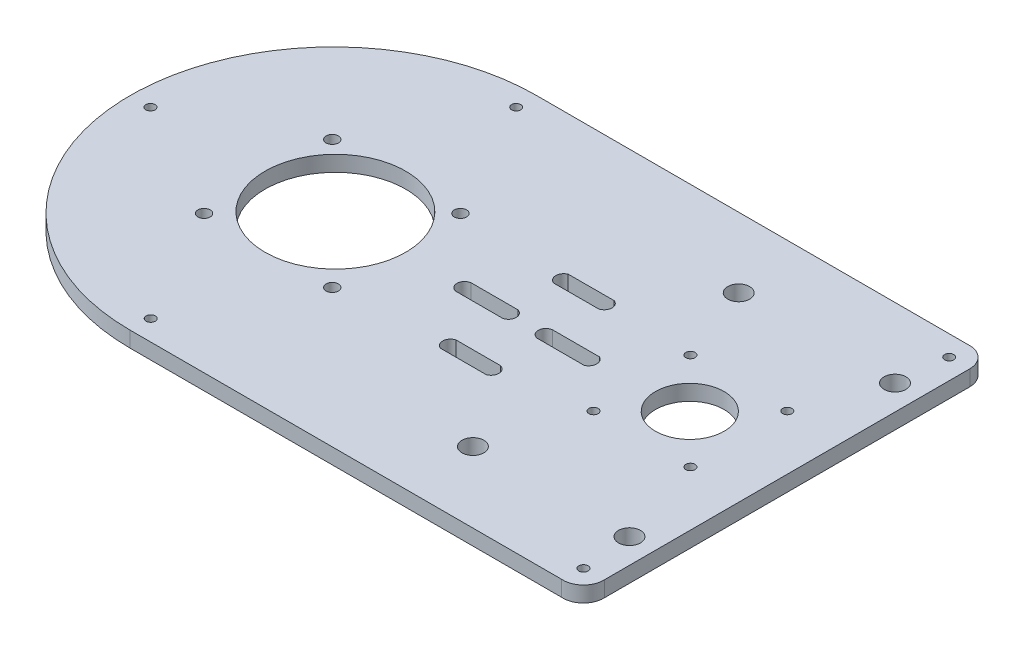
from build123d import *

# Parameters (mm, degrees)
BOSS_EXTRUDE1_DEPTH = 5
SKETCH3_R           = 1.475
CUT_EXTRUDE1_DEPTH  = 137.064643721
SKETCH4_R           = 22.5
SKETCH4_R_2         = 11
SKETCH4_R_3         = 1.975
SKETCH4_R_4         = 1.475
SKETCH4_R_5         = 3.5
CUT_EXTRUDE2_DEPTH  = 137.064643721


with BuildPart() as part:
    # Sketch2 → Boss-Extrude1 (new body)
    with BuildSketch(Plane(origin=(0, 0, 0), x_dir=(1, 0, 0), z_dir=(0, 1, 0))):
        with BuildLine():
            Line((-52.202038886, 61.082677165), (85.797961114, 61.082677165))
            ThreePointArc((85.797961114, 61.082677165), (90.6611457, 59.421487905), (92.797961114, 54.747717054))
            Line((92.797961114, 54.747717054), (92.797961114, -62.252282946))
            ThreePointArc((92.797961114, -62.252282946), (90.782438223, -67.143884297), (85.797961114, -68.917322835))
            Line((85.797961114, -68.917322835), (-52.202038886, -68.917322835))
            ThreePointArc((-52.202038886, -68.917322835), (-117.202038886, -3.917322835), (-52.202038886, 61.082677165))
        make_face()
    extrude(amount=BOSS_EXTRUDE1_DEPTH)

    # Sketch3 → Cut-Extrude1 (cut, through all)
    with BuildSketch(Plane(origin=(0, 5, 0), x_dir=(1, 0, 0), z_dir=(0, 1, 0))):
        with Locations(Location((86.297961114, 54.582677165, 0), (0, 0, 270))):
            Circle(SKETCH3_R)
        with Locations(Location((-52.202038886, 54.582677165, 0), (0, 0, 270))):
            Circle(SKETCH3_R)
        with Locations(Location((-110.702038886, -3.912214457, 0), (0, 0, 270))):
            Circle(SKETCH3_R)
        with Locations(Location((86.297961114, -62.417322835, 0), (0, 0, 90))):
            Circle(SKETCH3_R)
        with Locations(Location((-52.11000774, -62.417322835, 0), (0, 0, 90))):
            Circle(SKETCH3_R)
    extrude(amount=-CUT_EXTRUDE1_DEPTH, mode=Mode.SUBTRACT)

    # Sketch4 → Cut-Extrude2 (cut, through all)
    with BuildSketch(Plane(origin=(0, 5, 0), x_dir=(1, 0, 0), z_dir=(0, 1, 0))):
        with BuildLine():
            Line((17.035736777, 16.673447137), (2.353343762, 16.650369213))
            ThreePointArc((2.353343762, 16.650369213), (0.763165117, 14.196667771), (2.526429623, 11.864240457))
            Line((2.526429623, 11.864240457), (16.842011582, 11.886741824))
            ThreePointArc((16.842011582, 11.886741824), (18.721537255, 14.207947413), (17.035736777, 16.673447137))
        make_face()
        with BuildLine():
            Line((4.221952, -1.260399725), (-10.778048, -1.260399725))
            ThreePointArc((-10.778048, -1.260399725), (-12.893391284, -3.603735064), (-10.910792873, -6.060399725))
            Line((-10.910792873, -6.060399725), (4.221952, -6.060399725))
            ThreePointArc((4.221952, -6.060399725), (6.021952, -3.660399725), (4.221952, -1.260399725))
        make_face()
        with BuildLine():
            Line((30.221952, -1.260399725), (15.221952, -1.260399725))
            ThreePointArc((15.221952, -1.260399725), (13.106608716, -3.603735064), (15.089207127, -6.060399725))
            Line((15.089207127, -6.060399725), (30.147453765, -6.060399725))
            ThreePointArc((30.147453765, -6.060399725), (31.77239266, -3.68504141), (30.221952, -1.260399725))
        make_face()
        with BuildLine():
            Line((16.866686946, -19.510676527), (2.551087303, -19.510676527))
            ThreePointArc((2.551087303, -19.510676527), (0.791491102, -21.845872472), (2.385524529, -24.297071429))
            Line((2.385524529, -24.297071429), (17.06793568, -24.297071429))
            ThreePointArc((17.06793568, -24.297071429), (18.749858786, -21.828924997), (16.866686946, -19.510676527))
        make_face()
        with Locations(Location((-52.181545547, -3.280325568, 0), (0, 0, 270))):
            Circle(SKETCH4_R)
        with Locations(Location((59.810085593, -1.911181789, 0), (0, 0, 270))):
            Circle(SKETCH4_R_2)
        with Locations(Location((-72.707038886, 16.240452632, 0), (0, 0, 270))):
            Circle(SKETCH4_R_3)
        with Locations(Location((-72.707038886, -24.769547368, 0), (0, 0, 270))):
            Circle(SKETCH4_R_3)
        with Locations(Location((-31.697038886, -24.769547368, 0), (0, 0, 90))):
            Circle(SKETCH4_R_3)
        with Locations(Location((-31.697038886, 16.240452632, 0), (0, 0, 90))):
            Circle(SKETCH4_R_3)
        with Locations(Location((44.310085593, 13.788312606, 0), (0, 0, 270))):
            Circle(SKETCH4_R_4)
        with Locations(Location((44.310085593, -17.211687394, 0), (0, 0, 270))):
            Circle(SKETCH4_R_4)
        with Locations(Location((75.310085593, -17.211687394, 0), (0, 0, 90))):
            Circle(SKETCH4_R_4)
        with Locations(Location((75.310085593, 13.788312606, 0), (0, 0, 90))):
            Circle(SKETCH4_R_4)
        with Locations(Location((84.797961114, 38.74145607, 0), (0, 0, 270))):
            Circle(SKETCH4_R_5)
        with Locations(Location((34.797961114, 38.74145607, 0), (0, 0, 270))):
            Circle(SKETCH4_R_5)
        with Locations(Location((84.864762974, -46.25854393, 0), (0, 0, 270))):
            Circle(SKETCH4_R_5)
        with Locations(Location((34.864824738, -46.337134304, 0), (0, 0, 270))):
            Circle(SKETCH4_R_5)
    extrude(amount=-CUT_EXTRUDE2_DEPTH, mode=Mode.SUBTRACT)


solid = part.part
